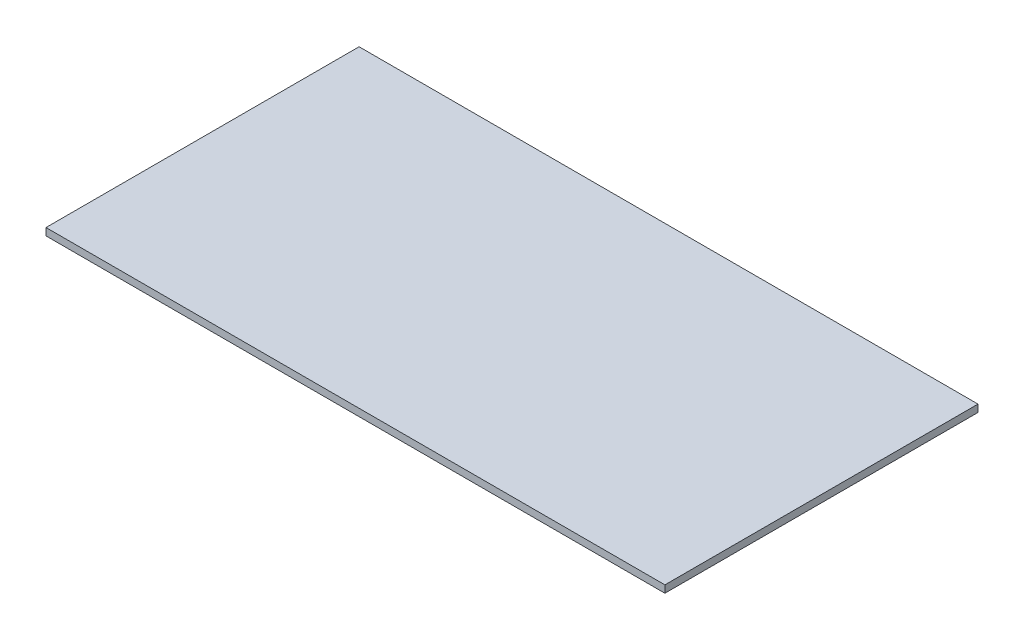
from build123d import *

# Parameters (mm, degrees)
SCHIZZO1_W                   = 850
SCHIZZO1_H                   = 430
ESTRUSIONE_ESTRUSIONE1_DEPTH = 10


with BuildPart() as part:
    # Schizzo1 → Estrusione-Estrusione1 (new body)
    with BuildSketch(Plane(origin=(0, 0, 0), x_dir=(1, 0, 0), z_dir=(0, 1, 0))):
        Rectangle(SCHIZZO1_W, SCHIZZO1_H)
    extrude(amount=ESTRUSIONE_ESTRUSIONE1_DEPTH)


solid = part.part
